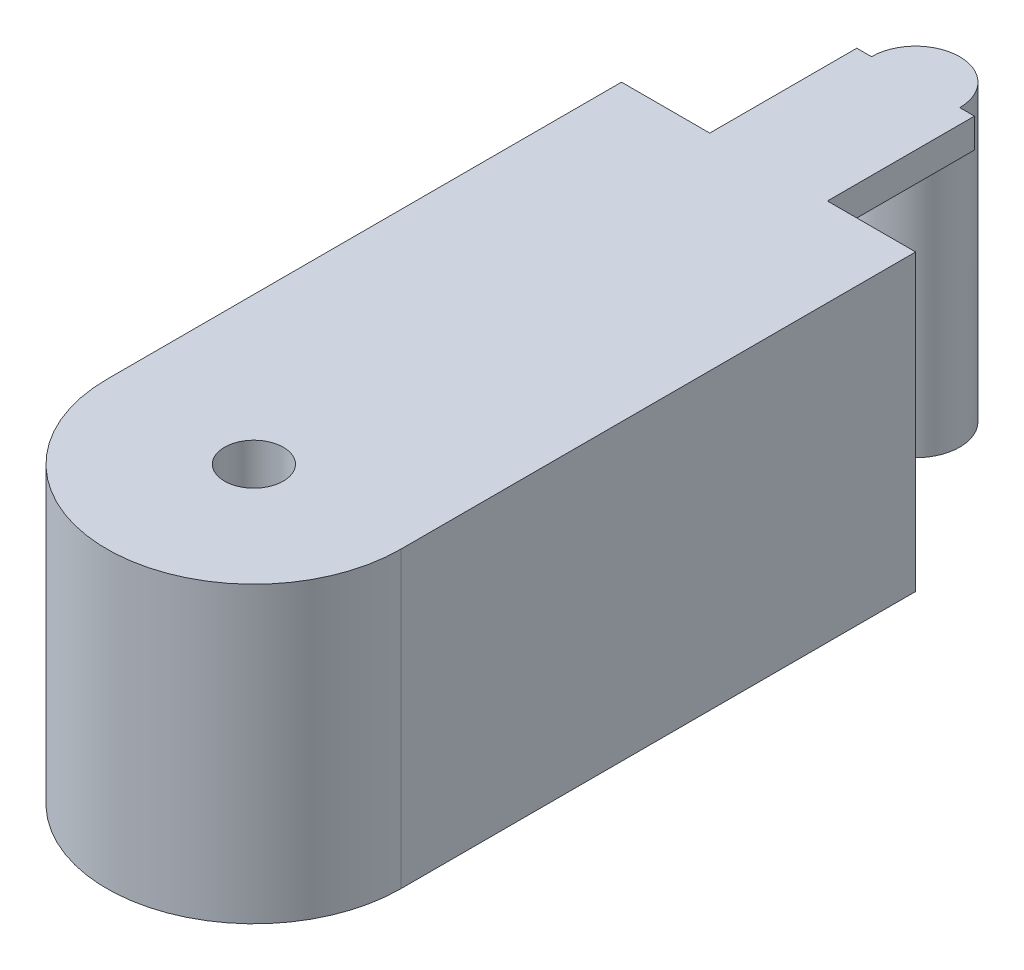
from build123d import *

# Parameters (mm, degrees)
SKETCH2_R           = 50
SKETCH2_R_2         = 10
BOSS_EXTRUDE1_DEPTH = 100
BOSS_EXTRUDE2_START = -100
BOSS_EXTRUDE2_DEPTH = 100
BOSS_EXTRUDE3_DEPTH = 10
BOSS_EXTRUDE4_DEPTH = 100


with BuildPart() as part:
    # Sketch2 → Boss-Extrude1 (new body)
    with BuildSketch(Plane(origin=(0, 0, 0), x_dir=(1, 0, 0), z_dir=(0, 1, 0))):
        with Locations(Location((0, 0, 0), (0, 0, 270))):
            Circle(SKETCH2_R)
        with Locations(Location((0, 0, 0), (0, 0, 270))):
            Circle(SKETCH2_R_2, mode=Mode.SUBTRACT)
    extrude(amount=BOSS_EXTRUDE1_DEPTH)

    # Sketch3 → Boss-Extrude2 (add)
    with BuildSketch(Plane(origin=(0, 100, 0), x_dir=(1, 0, 0), z_dir=(0, 1, 0)).offset(BOSS_EXTRUDE2_START)):
        with BuildLine():
            ThreePointArc((-50, 0), (0, 50), (50, 0))
            Line((50, 0), (50, 175))
            Line((50, 175), (-50, 175))
            Line((-50, 175), (-50, 0))
        make_face()
    extrude(amount=BOSS_EXTRUDE2_DEPTH)

    # Sketch4 → Boss-Extrude3 (add)
    with BuildSketch(Plane(origin=(0, 100, 0), x_dir=(1, 0, 0), z_dir=(0, 1, 0))):
        with BuildLine():
            Line((-20, 175), (20, 175))
            Line((20, 175), (20, 225))
            Line((20, 225), (15, 225))
            ThreePointArc((15, 225), (0, 210), (-15, 225))
            Line((-15, 225), (-20, 225))
            Line((-20, 225), (-20, 175))
        make_face()
    extrude(amount=-BOSS_EXTRUDE3_DEPTH)

    # Sketch4<3> → Boss-Extrude4 (add)
    with BuildSketch(Plane(origin=(0, 100, 0), x_dir=(1, 0, 0), z_dir=(0, 1, 0))):
        with BuildLine():
            ThreePointArc((-15, 225), (0, 210), (15, 225))
            Line((15, 225), (-15, 225))
        make_face()
        with BuildLine():
            Line((-15, 225), (15, 225))
            ThreePointArc((15, 225), (0, 240), (-15, 225))
        make_face()
    extrude(amount=-BOSS_EXTRUDE4_DEPTH)


solid = part.part
